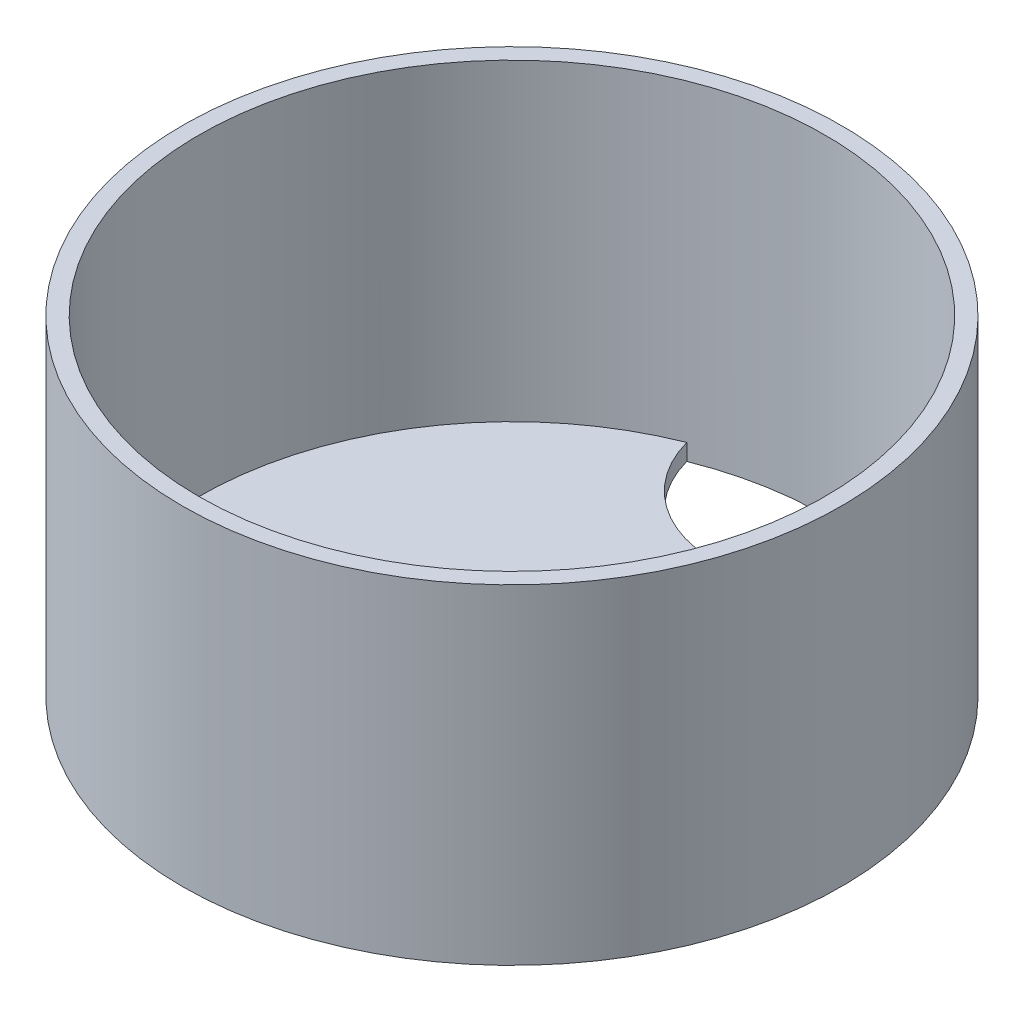
from build123d import *

# Parameters (mm, degrees)
SKETCH1_R           = 40
BOSS_EXTRUDE1_DEPTH = 40
SKETCH2_R           = 38
CUT_EXTRUDE1_DEPTH  = 38
CUT_EXTRUDE2_DEPTH  = 38
SKETCH4_R           = 5
CUT_EXTRUDE3_DEPTH  = 38


with BuildPart() as part:
    # Sketch1 → Boss-Extrude1 (new body)
    with BuildSketch(Plane(origin=(0, 0, 0), x_dir=(1, 0, 0), z_dir=(0, 1, 0))):
        with Locations(Location((0, 0, 0), (0, 0, 270))):
            Circle(SKETCH1_R)
    extrude(amount=BOSS_EXTRUDE1_DEPTH)

    # Sketch2 → Cut-Extrude1 (cut)
    with BuildSketch(Plane(origin=(0, 40, 0), x_dir=(1, 0, 0), z_dir=(0, 1, 0))):
        with Locations(Location((0, 0, 0), (0, 0, 270))):
            Circle(SKETCH2_R)
    extrude(amount=-CUT_EXTRUDE1_DEPTH, mode=Mode.SUBTRACT)

    # Sketch3 → Cut-Extrude2 (cut)
    with BuildSketch(Plane(origin=(0, 2, 0), x_dir=(1, 0, 0), z_dir=(0, 1, 0))):
        with BuildLine():
            ThreePointArc((-14.076066703, 35.296803626), (0, 24.534862453), (14.076066703, 35.296803626))
            ThreePointArc((14.076066703, 35.296803626), (0, 38), (-14.076066703, 35.296803626))
        make_face()
    extrude(amount=-CUT_EXTRUDE2_DEPTH, mode=Mode.SUBTRACT)

    # Sketch4 → Cut-Extrude3 (cut)
    with BuildSketch(Plane(origin=(0, 2, 0), x_dir=(1, 0, 0), z_dir=(0, 1, 0))):
        with Locations(Location((0, 0, 0), (0, 0, 270))):
            Circle(SKETCH4_R)
    extrude(amount=-CUT_EXTRUDE3_DEPTH, mode=Mode.SUBTRACT)


solid = part.part
